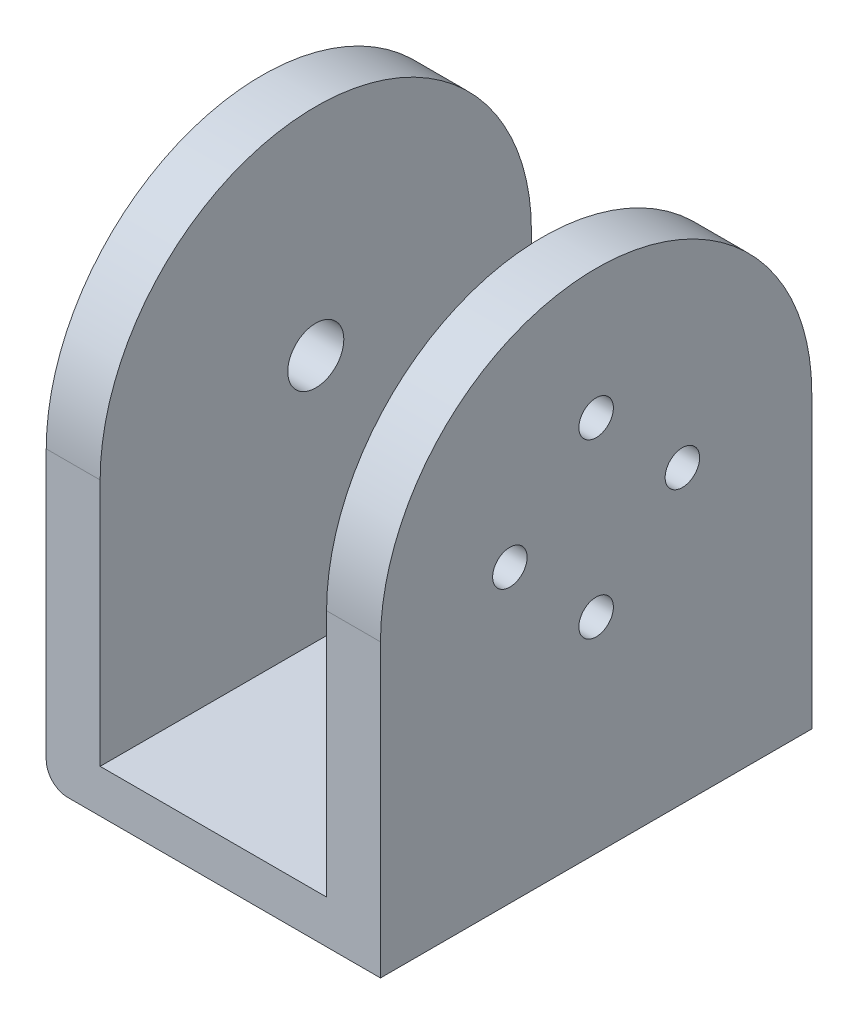
from build123d import *

# Parameters (mm, degrees)
SKETCH1_W             = 46
SKETCH1_H             = 40
BOSS_EXTRUDE1_DEPTH   = 4
SKETCH2_W             = 40
SKETCH2_H             = 45
BOSS_EXTRUDE2_DEPTH   = 5
BOSS_EXTRUDE3_DEPTH   = 20
SKETCH6_R             = 2.9
SKETCH6_R_2           = 1.55
SKETCH6_R_3           = 1.4
CUT_EXTRUDE2_DEPTH    = 9
FILLET1_R             = 2
FILLET2_R             = 2
CUT_EXTRUDE4_START    = -10
CUT_EXTRUDE4_DEPTH    = 10
SKETCH12_W            = 5
SKETCH12_H            = 40
CUT_EXTRUDE5_DEPTH    = 45
IZIM1_R               = 1.6
KES_EKSTR_ZYON1_DEPTH = 25
IZIM2_R               = 2.6
KES_EKSTR_ZYON2_DEPTH = 10
CUT_EXTRUDE11_DEPTH   = 15
SKETCH19_W            = 15
SKETCH19_H            = 40
CUT_EXTRUDE12_DEPTH   = 15
SKETCH20_R            = 1.4
SKETCH20_R_2          = 2.9
BOSS_EXTRUDE4_DEPTH   = 4


with BuildPart() as part:
    # Sketch1 → Boss-Extrude1 (new body)
    with BuildSketch(Plane(origin=(0, 0, 0), x_dir=(1, 0, 0), z_dir=(0, 1, 0))):
        Rectangle(SKETCH1_W, SKETCH1_H)
    extrude(amount=BOSS_EXTRUDE1_DEPTH)

    # Sketch2 → Boss-Extrude2 (add)
    with BuildSketch(Plane.ZY.offset(23)):
        with Locations((0, 26.5)):
            Rectangle(SKETCH2_W, SKETCH2_H)
    extrude(amount=-BOSS_EXTRUDE2_DEPTH)

    # Sketch3 → Boss-Extrude3 (add)
    with BuildSketch(Plane(origin=(23, 0, 0), x_dir=(0, 0, -1), z_dir=(1, 0, 0))):
        with BuildLine():
            Line((-20, 27), (-20, 2))
            Line((-20, 2), (20, 2))
            Line((20, 2), (20, 27))
            ThreePointArc((20, 27), (0, 47), (-20, 27))
        make_face()
    extrude(amount=-BOSS_EXTRUDE3_DEPTH)

    # Sketch6 → Cut-Extrude2 (cut)
    with BuildSketch(Plane(origin=(0, 4, 0), x_dir=(1, 0, 0), z_dir=(0, 1, 0))):
        with Locations(Location((0, 0, 0), (0, 0, 270))):
            Circle(SKETCH6_R)
        with Locations(Location((-4.99, 4.99, 0), (0, 0, 270))):
            Circle(SKETCH6_R_2)
        with Locations(Location((4.99, 4.99, 0), (0, 0, 270))):
            Circle(SKETCH6_R_3)
        with Locations(Location((-4.99, -4.98, 0), (0, 0, 270))):
            Circle(SKETCH6_R_2)
        with Locations(Location((4.99, -4.98, 0), (0, 0, 270))):
            Circle(SKETCH6_R_3)
    extrude(amount=-CUT_EXTRUDE2_DEPTH, mode=Mode.SUBTRACT)

    # Fillet1
    fillet1_edges = [part.edges().sort_by_distance(p)[0] for p in [
        (23, 0, 0),
    ]]
    fillet(fillet1_edges, radius=FILLET1_R)

    # Fillet2
    fillet2_edges = [part.edges().sort_by_distance(p)[0] for p in [
        (-23, 0, 0),
    ]]
    fillet(fillet2_edges, radius=FILLET2_R)

    # Sketch11 → Cut-Extrude4 (cut)
    with BuildSketch(Plane.ZY.offset(23).offset(CUT_EXTRUDE4_START)):
        with BuildLine():
            ThreePointArc((0, 47), (14.142135624, 41.142135624), (20, 27))
            Line((20, 27), (20, 47))
            Line((20, 47), (0, 47))
        make_face()
        with BuildLine():
            Line((-20, 47), (-20, 27))
            ThreePointArc((-20, 27), (-14.142135624, 41.142135624), (0, 47))
            Line((0, 47), (-20, 47))
        make_face()
    extrude(amount=CUT_EXTRUDE4_DEPTH, mode=Mode.SUBTRACT)


with BuildPart() as cut_extrude4_piece_1:
    # of the separate pieces the step leaves, piece 1, a body of its own (cut_extrude4_pieces)
    add(part.part.solids().sort_by_distance((-21, 0, -20))[0])

    # Çizim1 → Kes-Ekstrüzyon1 (cut)
    with BuildSketch(Plane(origin=(23, 0, 0), x_dir=(0, 0, -1), z_dir=(1, 0, 0))):
        with Locations((8, 27)):
            Circle(IZIM1_R)
        with Locations((0, 35)):
            Circle(IZIM1_R)
        with Locations((-8, 27)):
            Circle(IZIM1_R)
        with Locations((0, 19)):
            Circle(IZIM1_R)
    extrude(amount=-KES_EKSTR_ZYON1_DEPTH, mode=Mode.SUBTRACT)

    # Çizim2 → Kes-Ekstrüzyon2 (cut)
    with BuildSketch(Plane.ZY.offset(23)):
        with Locations((0, 27)):
            Circle(IZIM2_R)
    extrude(amount=-KES_EKSTR_ZYON2_DEPTH, mode=Mode.SUBTRACT)

    # Sketch18 → Cut-Extrude11 (cut)
    with BuildSketch(Plane(origin=(23, 0, 0), x_dir=(0, 0, -1), z_dir=(1, 0, 0))):
        with BuildLine():
            Line((-20, 27), (-20, 2))
            Line((-20, 2), (20, 2))
            Line((20, 2), (20, 27))
            ThreePointArc((20, 27), (0, 47), (-20, 27))
        make_face()
    extrude(amount=-CUT_EXTRUDE11_DEPTH, mode=Mode.SUBTRACT)

    # Sketch19 → Cut-Extrude12 (cut)
    with BuildSketch(Plane(origin=(0, 2, 0), x_dir=(1, 0, 0), z_dir=(0, 1, 0))):
        with Locations((15.5, 0)):
            Rectangle(SKETCH19_W, SKETCH19_H)
    extrude(amount=-CUT_EXTRUDE12_DEPTH, mode=Mode.SUBTRACT)

    # Sketch20 → Boss-Extrude4 (add)
    with BuildSketch(Plane(origin=(0, 0, 0), x_dir=(-1, 0, 0), z_dir=(0, -1, 0))):
        with Locations((-4.99, -4.98)):
            Circle(SKETCH20_R)
        with Locations((-4.99, 4.99)):
            Circle(SKETCH20_R)
        Circle(SKETCH20_R_2)
    extrude(amount=-BOSS_EXTRUDE4_DEPTH)


with BuildPart() as cut_extrude4_piece_2:
    # of the separate pieces the step leaves, piece 2, a body of its own (cut_extrude4_pieces)
    add(part.part.solids().sort_by_distance((-18, 47, -20))[0])

    # Sketch12 → Cut-Extrude5 (cut)
    with BuildSketch(Plane(origin=(0, 49, 0), x_dir=(1, 0, 0), z_dir=(0, 1, 0))):
        with Locations((-20.5, 0)):
            Rectangle(SKETCH12_W, SKETCH12_H)
    extrude(amount=-CUT_EXTRUDE5_DEPTH, mode=Mode.SUBTRACT)


solid = cut_extrude4_piece_1.part
